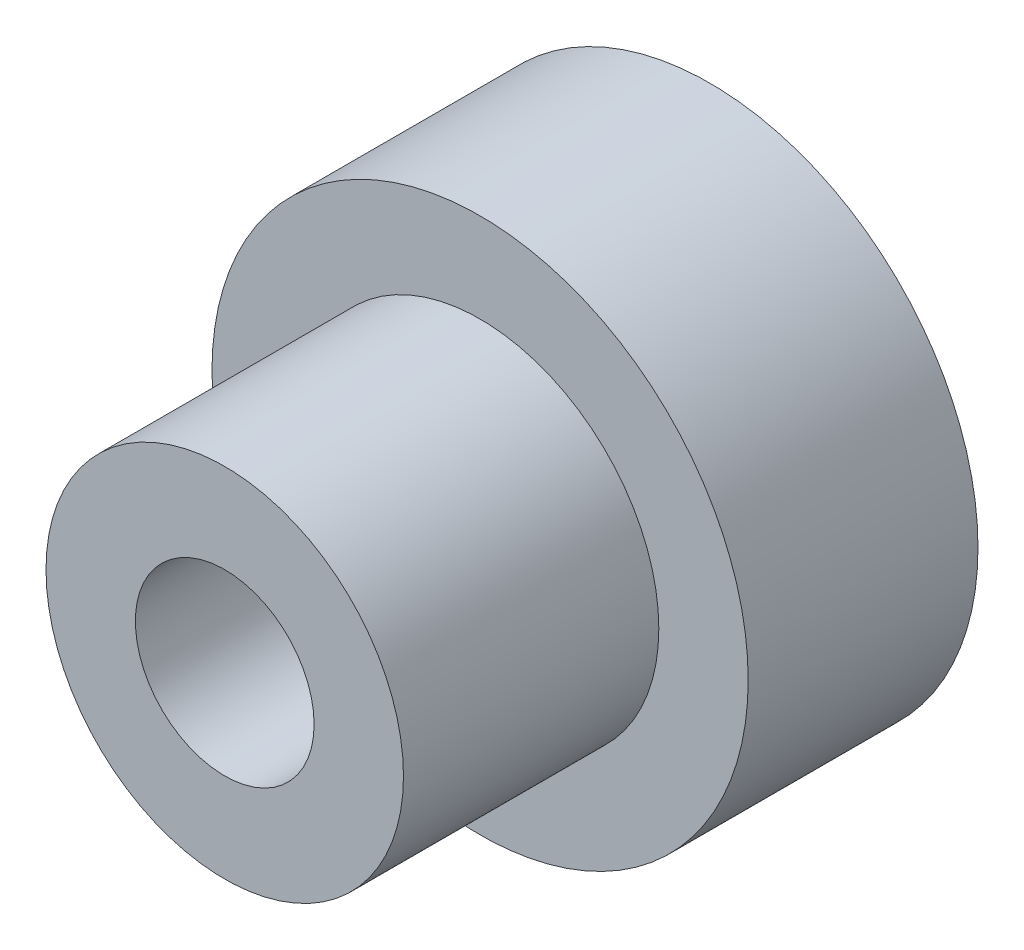
from build123d import *

# Parameters (mm, degrees)
SKETCH_2_R          = 7
EXTRUDE_1_DEPTH     = 10
SKETCH_3_R          = 10.5
EXTRUDE_2_DEPTH     = 9
SKETCH_4_R          = 3.5
CUT_EXTRUDE_1_DEPTH = 25.114311104
CUT_EXTRUDE_START   = -13
SKETCH_5_R          = 5.5
CUT_EXTRUDE_2_DEPTH = 2.5


with BuildPart() as part:
    # Эскиз2 → Бобышка-Вытянуть1 (new body)
    with BuildSketch(Plane.XY):
        Circle(SKETCH_2_R)
    extrude(amount=EXTRUDE_1_DEPTH)

    # Эскиз3 → Бобышка-Вытянуть2 (add)
    with BuildSketch(Plane(origin=(0, 0, 0), x_dir=(-1, 0, 0), z_dir=(0, 0, -1))):
        Circle(SKETCH_3_R)
    extrude(amount=EXTRUDE_2_DEPTH)

    # Эскиз4 → Вырез-Вытянуть1 (cut, through all)
    with BuildSketch(Plane.XY.offset(10)):
        Circle(SKETCH_4_R)
    extrude(amount=-CUT_EXTRUDE_1_DEPTH, mode=Mode.SUBTRACT)

    # Эскиз5 → Вырез-Вытянуть2 (cut)
    with BuildSketch(Plane.XY.offset(10).offset(CUT_EXTRUDE_START)):
        Circle(SKETCH_5_R)
    extrude(amount=-CUT_EXTRUDE_2_DEPTH, mode=Mode.SUBTRACT)


solid = part.part
